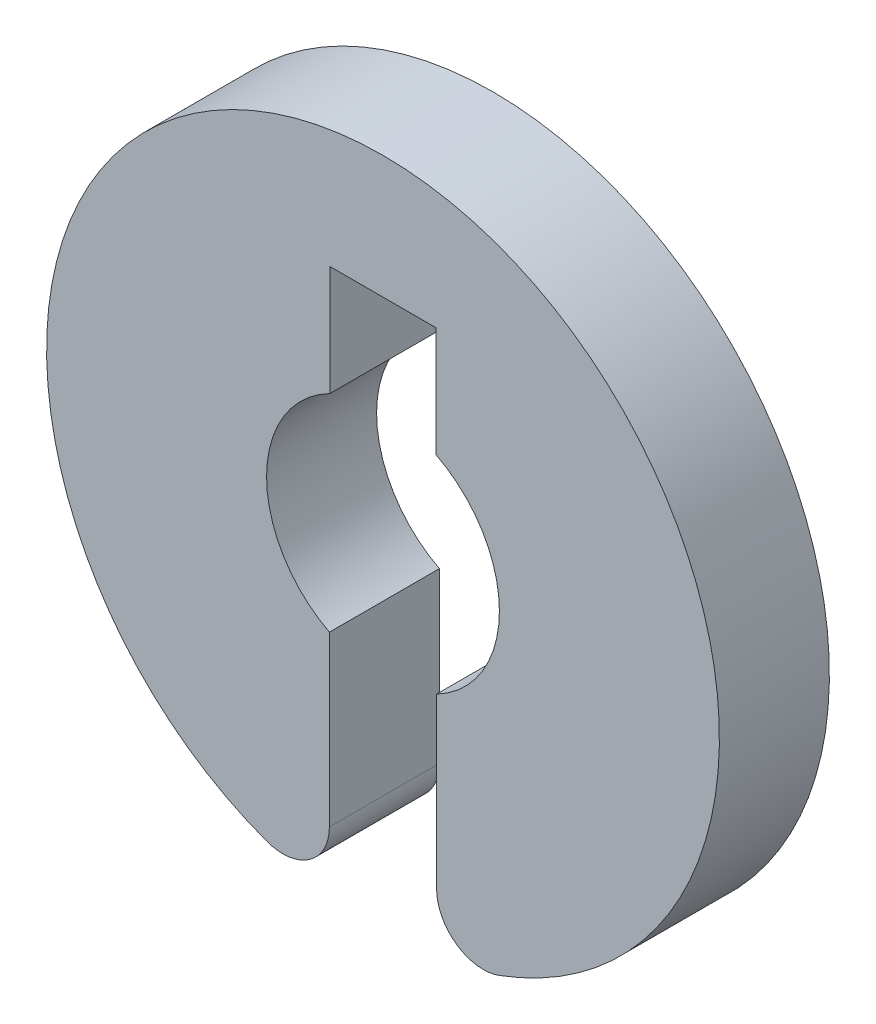
from build123d import *

# Parameters (mm, degrees)
EXTRUDE_1_DEPTH = 3
FILLET_1_R      = 1.27


with BuildPart() as part:
    # 스케치1 → 보스-돌출1 (new body)
    with BuildSketch(Plane.XY):
        with BuildLine():
            Line((-1.4475, 5.825839477), (1.4475, 5.825839477))
            Line((1.4475, 5.825839477), (1.4475, 2.825839477))
            ThreePointArc((1.4475, 2.825839477), (3.174988787, 0.008438217), (1.4625, -2.818105525))
            Line((1.4625, -2.818105525), (1.4625, -9.057688378))
            ThreePointArc((1.4625, -9.057688378), (0, 9.175), (-1.4625, -9.057688378))
            Line((-1.4625, -9.057688378), (-1.4625, -2.818105525))
            ThreePointArc((-1.4625, -2.818105525), (-3.174988787, 0.008438217), (-1.4475, 2.825839477))
            Line((-1.4475, 2.825839477), (-1.4475, 5.825839477))
        make_face()
    extrude(amount=EXTRUDE_1_DEPTH)

    # 필렛1
    fillet_1_edges = [part.edges().sort_by_distance(p)[0] for p in [
        (-1.4625, -9.057688378, 1.5),
        (1.4625, -9.057688378, 1.5),
    ]]
    fillet(fillet_1_edges, radius=FILLET_1_R)


solid = part.part
